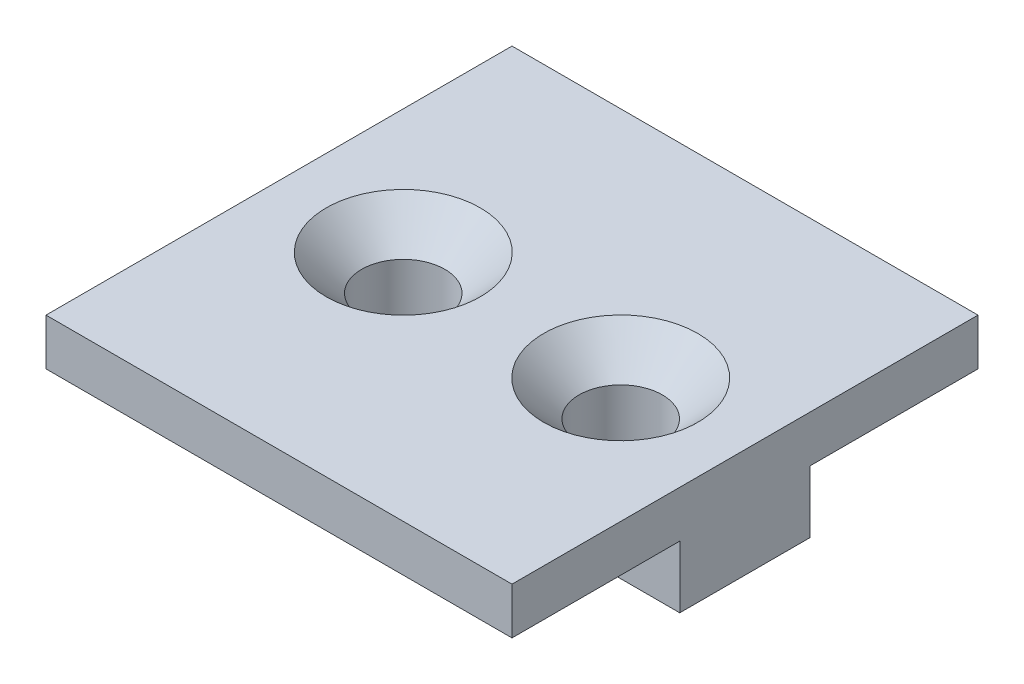
from build123d import *

# Parameters (mm, degrees)
SKETCH1_W                                       = 19.05
SKETCH1_H                                       = 5.334
BOSS_EXTRUDE1_DEPTH                             = 2.54
SKETCH2_W                                       = 19.05
SKETCH2_H                                       = 19.05
BOSS_EXTRUDE2_DEPTH                             = 1.905
CSK_FOR_M3_FLAT_HEAD_MACHINE_SCREW1_D           = 3.4
CSK_FOR_M3_FLAT_HEAD_MACHINE_SCREW1_CSINK_D     = 6.3
CSK_FOR_M3_FLAT_HEAD_MACHINE_SCREW1_CSINK_ANGLE = 90


with BuildPart() as part:
    # Sketch1 → Boss-Extrude1 (new body)
    with BuildSketch(Plane(origin=(0, 0, 0), x_dir=(1, 0, 0), z_dir=(0, 1, 0))):
        Rectangle(SKETCH1_W, SKETCH1_H)
    extrude(amount=BOSS_EXTRUDE1_DEPTH)

    # Sketch2 → Boss-Extrude2 (add)
    with BuildSketch(Plane(origin=(0, 2.54, 0), x_dir=(1, 0, 0), z_dir=(0, 1, 0))):
        Rectangle(SKETCH2_W, SKETCH2_H)
    extrude(amount=BOSS_EXTRUDE2_DEPTH)

    # CSK for M3 Flat Head Machine Screw1 (through all)
    with Locations(Plane(origin=(0, 4.445, 0), x_dir=(1, 0, 0), z_dir=(0, 1, 0))):
        with Locations((-4.445, 0), (4.445, 0)):
            CounterSinkHole(CSK_FOR_M3_FLAT_HEAD_MACHINE_SCREW1_D / 2, CSK_FOR_M3_FLAT_HEAD_MACHINE_SCREW1_CSINK_D / 2, counter_sink_angle=CSK_FOR_M3_FLAT_HEAD_MACHINE_SCREW1_CSINK_ANGLE)


solid = part.part
